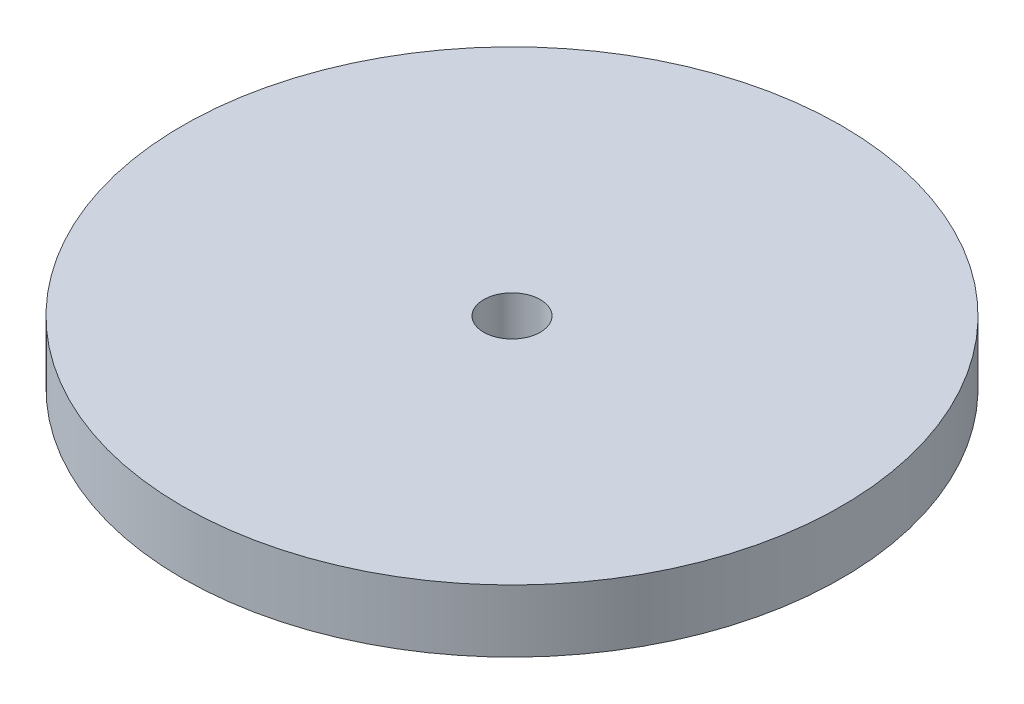
from build123d import *

# Parameters (mm, degrees)
SKETCH1_R           = 337.5
SKETCH1_R_2         = 29
BOSS_EXTRUDE1_DEPTH = 32


with BuildPart() as part:
    # Sketch1 → Boss-Extrude1 (new, symmetric)
    with BuildSketch(Plane(origin=(0, 0, 0), x_dir=(1, 0, 0), z_dir=(0, 1, 0))):
        with Locations(Location((0, 0, 0), (0, 0, 270))):
            Circle(SKETCH1_R)
        with Locations(Location((0, 0, 0), (0, 0, 270))):
            Circle(SKETCH1_R_2, mode=Mode.SUBTRACT)
    extrude(amount=BOSS_EXTRUDE1_DEPTH, both=True)


solid = part.part
